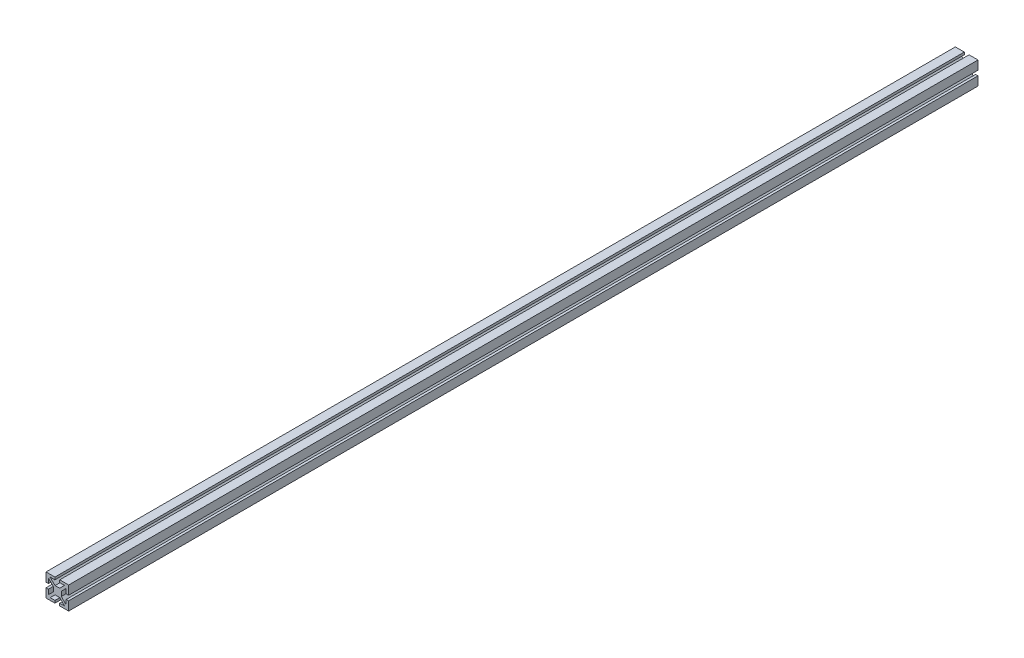
from build123d import *

# Parameters (mm, degrees)
BOSS_EXTRUDE1_DEPTH = 1531.14375


with BuildPart() as part:
    # Sketch2 → Boss-Extrude1 (new body)
    with BuildSketch(Plane(origin=(0.594697292, -0.594697292, 0), x_dir=(1, 0, 0), z_dir=(0, 0, 1))):
        Polygon((-19.644697292, 19.644697292), (-4.658697292, 19.644697292), (-4.658697292, 15.580697292), (-12.707015333, 15.580697292), (-4.477415333, 7.351097292), (3.288020749, 7.351097292), (11.517620749, 15.580697292), (3.469302708, 15.580697292), (3.469302708, 19.644697292), (18.455302708, 19.644697292), (18.455302708, 4.658697292), (14.391302708, 4.658697292), (14.391302708, 12.707015333), (6.161702708, 4.477415333), (6.161702708, -3.288020749), (14.391302708, -11.517620749), (14.391302708, -3.469302708), (18.455302708, -3.469302708), (18.455302708, -18.455302708), (3.469302708, -18.455302708), (3.469302708, -14.391302708), (11.517620749, -14.391302708), (3.288020749, -6.161702708), (-4.477415333, -6.161702708), (-12.707015333, -14.391302708), (-4.658697292, -14.391302708), (-4.658697292, -18.455302708), (-19.644697292, -18.455302708), (-19.644697292, -3.469302708), (-15.580697292, -3.469302708), (-15.580697292, -11.517620749), (-7.351097292, -3.288020749), (-7.351097292, 4.477415333), (-15.580697292, 12.707015333), (-15.580697292, 4.658697292), (-19.644697292, 4.658697292), align=None)
    extrude(amount=BOSS_EXTRUDE1_DEPTH)


solid = part.part
